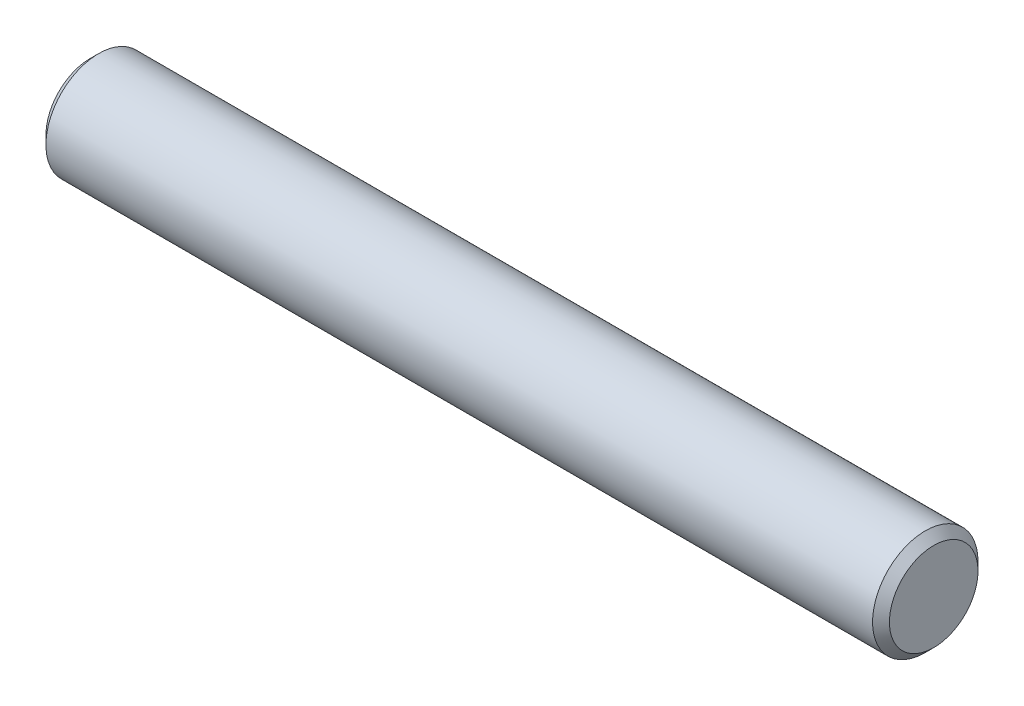
from build123d import *

# Parameters (mm, degrees)
SKETCH2_R     = 12.5
CHAMFER1_SIZE = 2


with BuildPart() as part:
    # Sweep1: sweep along a path in Sketch1
    with BuildLine(Plane(origin=(0, 0, 0), x_dir=(1, 0, 0), z_dir=(0, 1, 0))) as sweep1_path:
        Line((-100, 0), (100, 0))
    # Sketch2 → Sweep1 (sweep)
    with BuildSketch(Plane(origin=(0, 0, 0), x_dir=(0, 0, -1), z_dir=(1, 0, 0))):
        Circle(SKETCH2_R)
    sweep(path=sweep1_path.line)

    # Chamfer1
    chamfer1_edges = [part.edges().sort_by_distance(p)[0] for p in [
        (-100, 0, 12.5),
        (100, 0, 12.5),
    ]]
    chamfer(chamfer1_edges, length=CHAMFER1_SIZE)


solid = part.part
